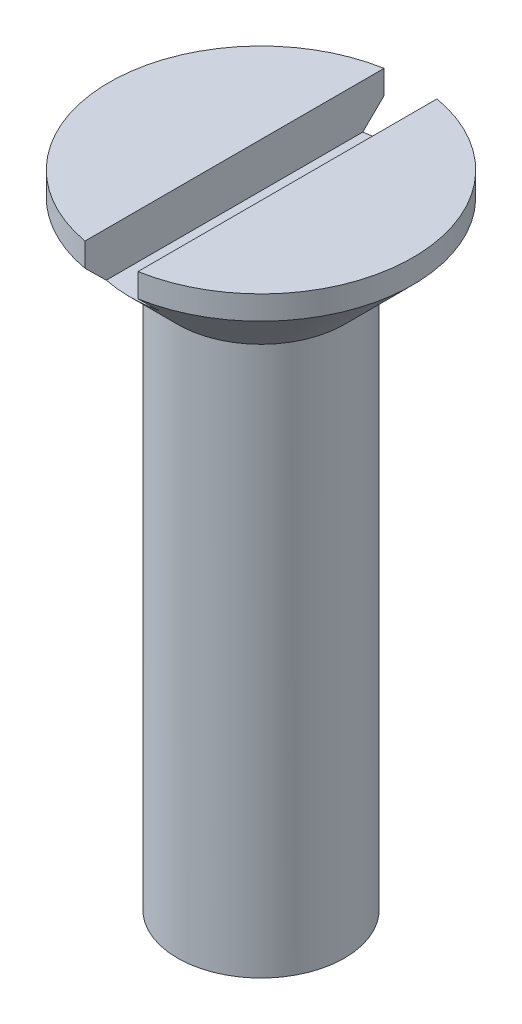
from build123d import *

# Parameters (mm, degrees)
SKETCH2_W          = 1.9
SKETCH2_H          = 10.9
CUT_EXTRUDE1_DEPTH = 1.6


with BuildPart() as part:
    # Sketch1 → Revolve1 (revolve)
    with BuildSketch(Plane.XY, mode=Mode.PRIVATE) as revolve1_sk:
        Polygon((0, 24.732050808), (5.45, 24.732050808), (5.45, 23.882050808), (3, 21.432050808), (3, 1.732050808), (0, 0), align=None)
    revolve(revolve1_sk.sketch.rotate(Axis((0, 0, 0), (0, 1, 0)), 90), axis=Axis((0, 0, 0), (0, 1, 0)))

    # Sketch2 → Cut-Extrude1 (cut)
    with BuildSketch(Plane(origin=(0, 24.732050808, 0), x_dir=(1, 0, 0), z_dir=(0, 1, 0))):
        Rectangle(SKETCH2_W, SKETCH2_H)
    extrude(amount=-CUT_EXTRUDE1_DEPTH, mode=Mode.SUBTRACT)


solid = part.part
